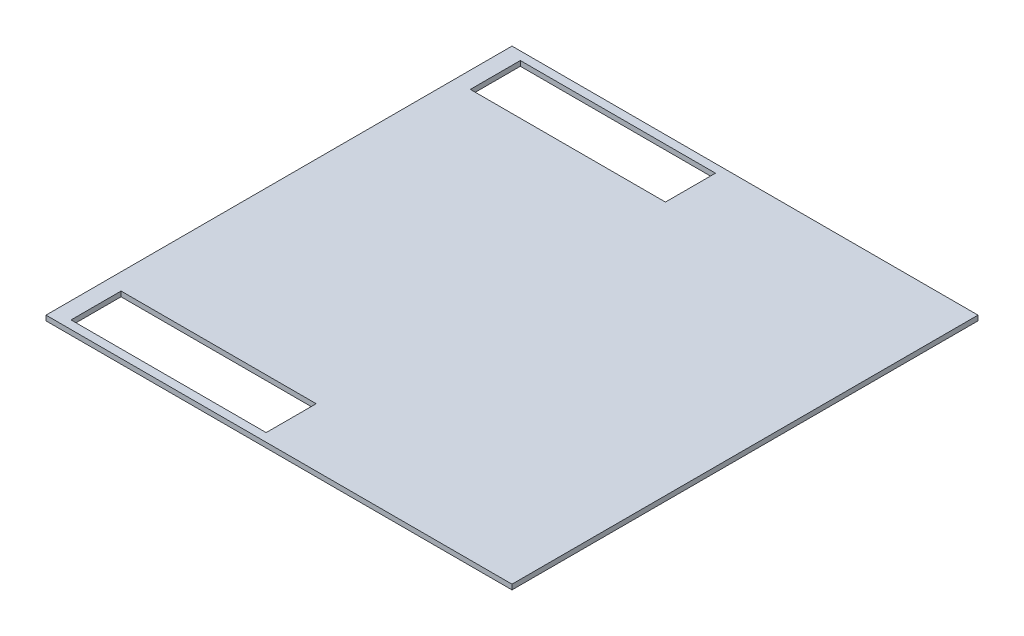
from build123d import *

# Parameters (mm, degrees)
SKETCH1_W           = 279.4
SKETCH1_H           = 279.4
SKETCH1_W_2         = 117
SKETCH1_H_2         = 30
BOSS_EXTRUDE1_DEPTH = 3


with BuildPart() as part:
    # Sketch1 → Boss-Extrude1 (new body)
    with BuildSketch(Plane(origin=(0, 0, 0), x_dir=(1, 0, 0), z_dir=(0, 1, 0))):
        Rectangle(SKETCH1_W, SKETCH1_H)
        with Locations((-71.2, 119.7)):
            Rectangle(SKETCH1_W_2, SKETCH1_H_2, mode=Mode.SUBTRACT)
        with Locations((-71.2, -119.7)):
            Rectangle(SKETCH1_W_2, SKETCH1_H_2, mode=Mode.SUBTRACT)
    extrude(amount=BOSS_EXTRUDE1_DEPTH)


solid = part.part
